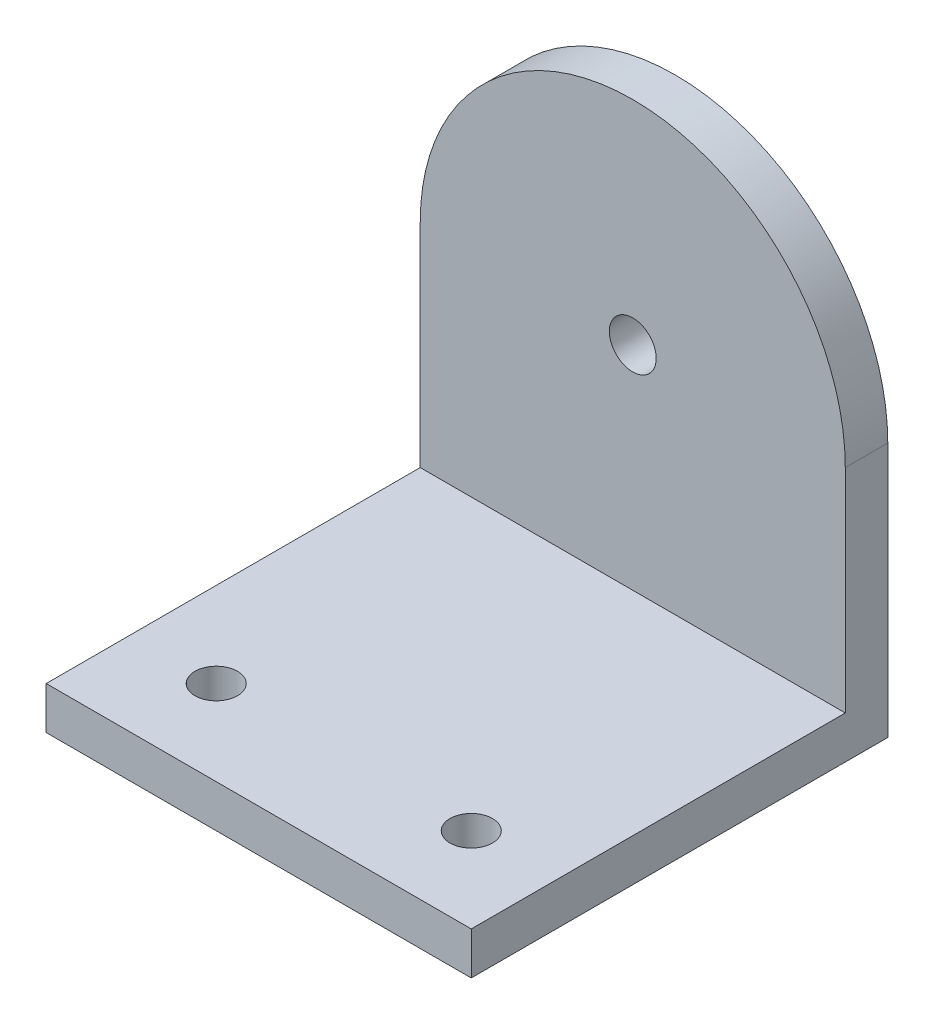
from build123d import *

# Parameters (mm, degrees)
BOSS_EXTRUDE1_DEPTH = 3.175
SKETCH4_W           = 31.75
SKETCH4_H           = 3.175
BOSS_EXTRUDE2_DEPTH = 27.94
SKETCH5_R           = 1.5875
CUT_EXTRUDE2_DEPTH  = 48.204039552
SKETCH6_R           = 1.75
CUT_EXTRUDE3_DEPTH  = 38.357217843


with BuildPart() as part:
    # Sketch1 → Boss-Extrude1 (new body)
    with BuildSketch(Plane.XY):
        with BuildLine():
            ThreePointArc((15.875, 0), (0, 15.875), (-15.875, 0))
            Line((-15.875, 0), (15.875, 0))
        make_face()
        with BuildLine():
            ThreePointArc((15.875, 0), (0, -15.875), (-15.875, 0))
            Line((-15.875, 0), (-15.875, -19.05))
            Line((-15.875, -19.05), (15.875, -19.05))
            Line((15.875, -19.05), (15.875, 0))
        make_face()
        with BuildLine():
            Line((15.875, 0), (-15.875, 0))
            ThreePointArc((-15.875, 0), (0, -15.875), (15.875, 0))
        make_face()
    extrude(amount=BOSS_EXTRUDE1_DEPTH)

    # Sketch4 → Boss-Extrude2 (add)
    with BuildSketch(Plane.XY.offset(3.175)):
        with Locations((0, -17.4625)):
            Rectangle(SKETCH4_W, SKETCH4_H)
    extrude(amount=BOSS_EXTRUDE2_DEPTH)

    # Sketch5 → Cut-Extrude2 (cut, through all)
    with BuildSketch(Plane(origin=(0, -15.875, 0), x_dir=(1, 0, 0), z_dir=(0, 1, 0))):
        with Locations(Location((-9.525, -24.765, 0), (0, 0, 270))):
            Circle(SKETCH5_R)
        with Locations(Location((9.525, -24.765, 0), (0, 0, 90))):
            Circle(SKETCH5_R)
    extrude(amount=-CUT_EXTRUDE2_DEPTH, mode=Mode.SUBTRACT)

    # Sketch6 → Cut-Extrude3 (cut, through all)
    with BuildSketch(Plane.XY.offset(3.175)):
        Circle(SKETCH6_R)
    extrude(amount=-CUT_EXTRUDE3_DEPTH, mode=Mode.SUBTRACT)


solid = part.part
